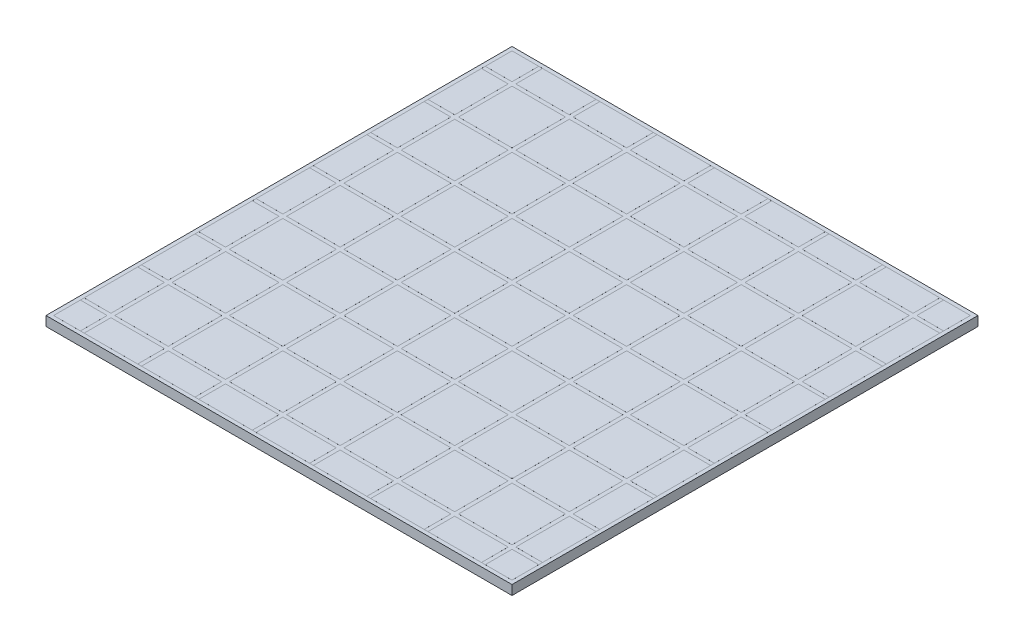
from build123d import *

# Parameters (mm, degrees)
SKETCH_1_W                         = 2440
SKETCH_1_H                         = 2440
EXTRUDE_1_DEPTH                    = 50
SKETCH_8_W                         = 2440
SKETCH_8_H                         = 2440
SKETCH_8_W_2                       = 2400
SKETCH_8_H_2                       = 2400
CUT_EXTRUDE_1_DEPTH                = 0.1
CUT_EXTRUDE_START                  = -0.1
SKETCH_9_W                         = 20
SKETCH_9_H                         = 2628.946859903
CUT_EXTRUDE_2_DEPTH                = 1727.164888699
PATTERN_LINEAR_1_COUNT             = 10
PATTERN_LINEAR_1_PITCH             = 300
PATTERN_CIRCULAR_1_COUNT           = 2
PATTERN_CIRCULAR_1_ANGLE           = 90
PATTERN_START                      = -0.1
PATTERN_CIRCULAR_1_COPY_1_SKETCH_W = 20
PATTERN_CIRCULAR_1_COPY_1_SKETCH_H = 2628.946859903
PATTERN_CIRCULAR_1_COPY_1_DEPTH    = 1727.164888699
PATTERN_CIRCULAR_1_COPY_2_SKETCH_W = 20
PATTERN_CIRCULAR_1_COPY_2_SKETCH_H = 2628.946859903
PATTERN_CIRCULAR_1_COPY_2_DEPTH    = 1727.164888699
PATTERN_CIRCULAR_1_COPY_3_SKETCH_W = 20
PATTERN_CIRCULAR_1_COPY_3_SKETCH_H = 2628.946859903
PATTERN_CIRCULAR_1_COPY_3_DEPTH    = 1727.164888699
PATTERN_CIRCULAR_1_COPY_4_SKETCH_W = 20
PATTERN_CIRCULAR_1_COPY_4_SKETCH_H = 2628.946859903
PATTERN_CIRCULAR_1_COPY_4_DEPTH    = 1727.164888699
PATTERN_CIRCULAR_1_COPY_5_SKETCH_W = 20
PATTERN_CIRCULAR_1_COPY_5_SKETCH_H = 2628.946859903
PATTERN_CIRCULAR_1_COPY_5_DEPTH    = 1727.164888699
PATTERN_CIRCULAR_1_COPY_6_SKETCH_W = 20
PATTERN_CIRCULAR_1_COPY_6_SKETCH_H = 2628.946859903
PATTERN_CIRCULAR_1_COPY_6_DEPTH    = 1727.164888699
PATTERN_CIRCULAR_1_COPY_7_SKETCH_W = 20
PATTERN_CIRCULAR_1_COPY_7_SKETCH_H = 2628.946859903
PATTERN_CIRCULAR_1_COPY_7_DEPTH    = 1727.164888699
PATTERN_CIRCULAR_1_COPY_8_SKETCH_W = 20
PATTERN_CIRCULAR_1_COPY_8_SKETCH_H = 2628.946859903
PATTERN_CIRCULAR_1_COPY_8_DEPTH    = 1727.164888699
PATTERN_CIRCULAR_1_COPY_9_SKETCH_W = 20
PATTERN_CIRCULAR_1_COPY_9_SKETCH_H = 2628.946859903
PATTERN_CIRCULAR_1_COPY_9_DEPTH    = 1727.164888699
SKETCH_10_W                        = 2440
SKETCH_10_H                        = 2440
SKETCH_10_W_2                      = 2400
SKETCH_10_H_2                      = 2400
EXTRUDE_3_DEPTH                    = 0.05


with BuildPart() as part:
    # Эскиз1 → Бобышка-Вытянуть1 (new body)
    with BuildSketch(Plane(origin=(0, 0, 0), x_dir=(1, 0, 0), z_dir=(0, 1, 0))):
        Rectangle(SKETCH_1_W, SKETCH_1_H)
    extrude(amount=-EXTRUDE_1_DEPTH)

    # Эскиз8 → Вырез-Вытянуть-Тонкостенный1 (cut)
    with BuildSketch(Plane(origin=(0, 0, 0), x_dir=(1, 0, 0), z_dir=(0, 1, 0))):
        Rectangle(SKETCH_8_W, SKETCH_8_H)
        Rectangle(SKETCH_8_W_2, SKETCH_8_H_2, mode=Mode.SUBTRACT)
    extrude(amount=-CUT_EXTRUDE_1_DEPTH, mode=Mode.SUBTRACT)

    # Эскиз9 → Вырез-Вытянуть-Тонкостенный2 (cut)
    with BuildSketch(Plane(origin=(0, 0, 0), x_dir=(1, 0, 0), z_dir=(0, 1, 0)).offset(CUT_EXTRUDE_START)):
        with Locations((-1050, -22.98030472)):
            Rectangle(SKETCH_9_W, SKETCH_9_H)
    cut_extrude_2 = extrude(amount=CUT_EXTRUDE_2_DEPTH, mode=Mode.SUBTRACT)

    # Линейный массив1: Вырез-Вытянуть-Тонкостенный2 ×10
    with Locations(*[(i * PATTERN_LINEAR_1_PITCH, 0, 0) for i in range(1, PATTERN_LINEAR_1_COUNT)]):
        add(cut_extrude_2, mode=Mode.SUBTRACT)

    # Круговой массив1: Вырез-Вытянуть-Тонкостенный2 ×2 about axis
    pattern_circular_1_axis = Axis((0, -50, 0), (0, 1, 0))
    for i in range(1, PATTERN_CIRCULAR_1_COUNT):
        add(cut_extrude_2.rotate(pattern_circular_1_axis, i * PATTERN_CIRCULAR_1_ANGLE / (PATTERN_CIRCULAR_1_COUNT - 1)), mode=Mode.SUBTRACT)

    # Круговой массив1 copy 1 sketch → Круговой массив1 copy 1 (cut)
    with BuildSketch(Plane(origin=(0, 0, -300), x_dir=(0, 0, -1), z_dir=(0, 1, 0)).offset(PATTERN_START)):
        with Locations((-1050, -22.98030472)):
            Rectangle(PATTERN_CIRCULAR_1_COPY_1_SKETCH_W, PATTERN_CIRCULAR_1_COPY_1_SKETCH_H)
    extrude(amount=PATTERN_CIRCULAR_1_COPY_1_DEPTH, mode=Mode.SUBTRACT)

    # Круговой массив1 copy 2 sketch → Круговой массив1 copy 2 (cut)
    with BuildSketch(Plane(origin=(0, 0, -600), x_dir=(0, 0, -1), z_dir=(0, 1, 0)).offset(PATTERN_START)):
        with Locations((-1050, -22.98030472)):
            Rectangle(PATTERN_CIRCULAR_1_COPY_2_SKETCH_W, PATTERN_CIRCULAR_1_COPY_2_SKETCH_H)
    extrude(amount=PATTERN_CIRCULAR_1_COPY_2_DEPTH, mode=Mode.SUBTRACT)

    # Круговой массив1 copy 3 sketch → Круговой массив1 copy 3 (cut)
    with BuildSketch(Plane(origin=(0, 0, -900), x_dir=(0, 0, -1), z_dir=(0, 1, 0)).offset(PATTERN_START)):
        with Locations((-1050, -22.98030472)):
            Rectangle(PATTERN_CIRCULAR_1_COPY_3_SKETCH_W, PATTERN_CIRCULAR_1_COPY_3_SKETCH_H)
    extrude(amount=PATTERN_CIRCULAR_1_COPY_3_DEPTH, mode=Mode.SUBTRACT)

    # Круговой массив1 copy 4 sketch → Круговой массив1 copy 4 (cut)
    with BuildSketch(Plane(origin=(0, 0, -1200), x_dir=(0, 0, -1), z_dir=(0, 1, 0)).offset(PATTERN_START)):
        with Locations((-1050, -22.98030472)):
            Rectangle(PATTERN_CIRCULAR_1_COPY_4_SKETCH_W, PATTERN_CIRCULAR_1_COPY_4_SKETCH_H)
    extrude(amount=PATTERN_CIRCULAR_1_COPY_4_DEPTH, mode=Mode.SUBTRACT)

    # Круговой массив1 copy 5 sketch → Круговой массив1 copy 5 (cut)
    with BuildSketch(Plane(origin=(0, 0, -1500), x_dir=(0, 0, -1), z_dir=(0, 1, 0)).offset(PATTERN_START)):
        with Locations((-1050, -22.98030472)):
            Rectangle(PATTERN_CIRCULAR_1_COPY_5_SKETCH_W, PATTERN_CIRCULAR_1_COPY_5_SKETCH_H)
    extrude(amount=PATTERN_CIRCULAR_1_COPY_5_DEPTH, mode=Mode.SUBTRACT)

    # Круговой массив1 copy 6 sketch → Круговой массив1 copy 6 (cut)
    with BuildSketch(Plane(origin=(0, 0, -1800), x_dir=(0, 0, -1), z_dir=(0, 1, 0)).offset(PATTERN_START)):
        with Locations((-1050, -22.98030472)):
            Rectangle(PATTERN_CIRCULAR_1_COPY_6_SKETCH_W, PATTERN_CIRCULAR_1_COPY_6_SKETCH_H)
    extrude(amount=PATTERN_CIRCULAR_1_COPY_6_DEPTH, mode=Mode.SUBTRACT)

    # Круговой массив1 copy 7 sketch → Круговой массив1 copy 7 (cut)
    with BuildSketch(Plane(origin=(0, 0, -2100), x_dir=(0, 0, -1), z_dir=(0, 1, 0)).offset(PATTERN_START)):
        with Locations((-1050, -22.98030472)):
            Rectangle(PATTERN_CIRCULAR_1_COPY_7_SKETCH_W, PATTERN_CIRCULAR_1_COPY_7_SKETCH_H)
    extrude(amount=PATTERN_CIRCULAR_1_COPY_7_DEPTH, mode=Mode.SUBTRACT)

    # Круговой массив1 copy 8 sketch → Круговой массив1 copy 8 (cut)
    with BuildSketch(Plane(origin=(0, 0, -2400), x_dir=(0, 0, -1), z_dir=(0, 1, 0)).offset(PATTERN_START)):
        with Locations((-1050, -22.98030472)):
            Rectangle(PATTERN_CIRCULAR_1_COPY_8_SKETCH_W, PATTERN_CIRCULAR_1_COPY_8_SKETCH_H)
    extrude(amount=PATTERN_CIRCULAR_1_COPY_8_DEPTH, mode=Mode.SUBTRACT)

    # Круговой массив1 copy 9 sketch → Круговой массив1 copy 9 (cut)
    with BuildSketch(Plane(origin=(0, 0, -2700), x_dir=(0, 0, -1), z_dir=(0, 1, 0)).offset(PATTERN_START)):
        with Locations((-1050, -22.98030472)):
            Rectangle(PATTERN_CIRCULAR_1_COPY_9_SKETCH_W, PATTERN_CIRCULAR_1_COPY_9_SKETCH_H)
    extrude(amount=PATTERN_CIRCULAR_1_COPY_9_DEPTH, mode=Mode.SUBTRACT)

    # Эскиз10 → Бобышка-Вытянуть3 (add)
    with BuildSketch(Plane(origin=(0, -0.1, 0), x_dir=(1, 0, 0), z_dir=(0, 1, 0))):
        Rectangle(SKETCH_10_W, SKETCH_10_H)
        Rectangle(SKETCH_10_W_2, SKETCH_10_H_2, mode=Mode.SUBTRACT)
    extrude(amount=EXTRUDE_3_DEPTH)


solid = part.part
